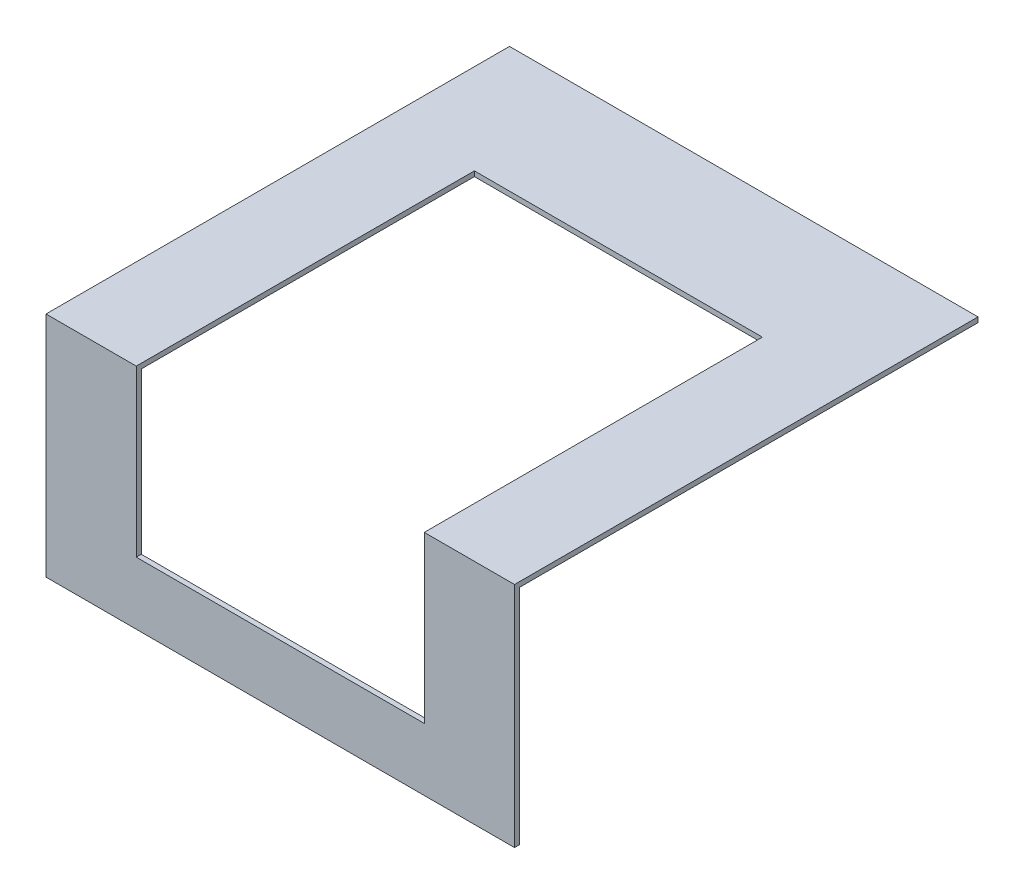
from build123d import *

# Parameters (mm, degrees)
SKETCH1_W           = 467.2
SKETCH1_H           = 222.25
BOSS_EXTRUDE1_DEPTH = 5
SKETCH2_W           = 467.2
SKETCH2_H           = 462.2
BOSS_EXTRUDE2_DEPTH = 5
SKETCH3_W           = 287.2
SKETCH3_H           = 674.4
CUT_EXTRUDE1_DEPTH  = 165


with BuildPart() as part:
    # Sketch1 → Boss-Extrude1 (new body)
    with BuildSketch(Plane.XY):
        Rectangle(SKETCH1_W, SKETCH1_H)
    extrude(amount=BOSS_EXTRUDE1_DEPTH)

    # Sketch2 → Boss-Extrude2 (add)
    with BuildSketch(Plane(origin=(0, 111.125, 0), x_dir=(1, 0, 0), z_dir=(0, 1, 0))):
        with Locations((0, 226.1)):
            Rectangle(SKETCH2_W, SKETCH2_H)
    extrude(amount=BOSS_EXTRUDE2_DEPTH)

    # Sketch3 → Cut-Extrude1 (cut)
    with BuildSketch(Plane(origin=(0, 116.125, 0), x_dir=(1, 0, 0), z_dir=(0, 1, 0))):
        with Locations((0, -5)):
            Rectangle(SKETCH3_W, SKETCH3_H)
    extrude(amount=-CUT_EXTRUDE1_DEPTH, mode=Mode.SUBTRACT)


solid = part.part
